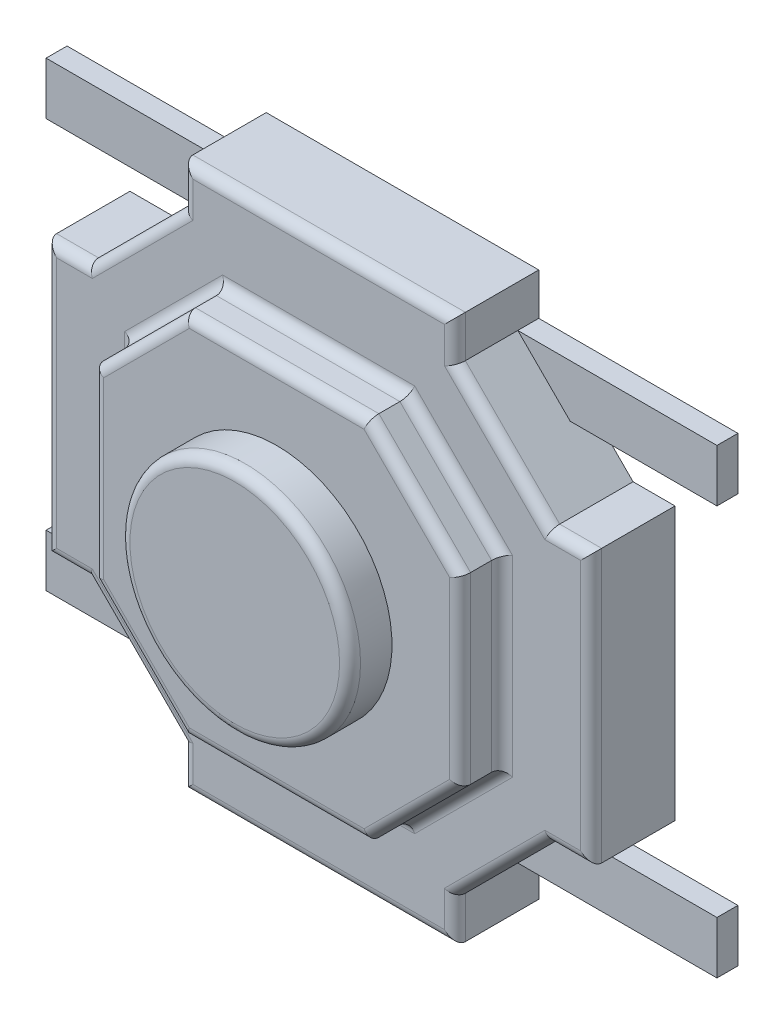
from build123d import *

# Parameters (mm, degrees)
BOSS_EXTRUDE1_DEPTH = 0.8
SKETCH3_W           = 6.4
SKETCH3_H           = 0.5
BOSS_EXTRUDE2_DEPTH = 0.2
BOSS_EXTRUDE3_DEPTH = 0.4
SKETCH5_R           = 1.1
BOSS_EXTRUDE4_DEPTH = 0.4
FILLET2_R           = 0.1
FILLET3_R           = 0.1
FILLET4_R           = 0.1


with BuildPart() as part:
    # Sketch1 → Boss-Extrude1 (new body)
    with BuildSketch(Plane.XY):
        Polygon((-1.3, 2.6), (1.3, 2.6), (1.3, 2.2), (2.2, 1.3), (2.6, 1.3), (2.6, -1.3), (2.2, -1.3), (1.3, -2.2), (1.3, -2.6), (-1.3, -2.6), (-1.3, -2.2), (-2.2, -1.3), (-2.6, -1.3), (-2.6, 1.3), (-2.2, 1.3), (-1.3, 2.2), align=None)
    extrude(amount=BOSS_EXTRUDE1_DEPTH)

    # Sketch3 → Boss-Extrude2 (add)
    with BuildSketch(Plane.XY):
        with Locations((0, 1.95)):
            Rectangle(SKETCH3_W, SKETCH3_H)
        with Locations((0, -1.95)):
            Rectangle(SKETCH3_W, SKETCH3_H)
    extrude(amount=BOSS_EXTRUDE2_DEPTH)

    # Sketch4 → Boss-Extrude3 (add)
    with BuildSketch(Plane.XY.offset(0.8)):
        Polygon((-0.875, 1.75), (0.875, 1.75), (1.75, 0.875), (1.75, -0.875), (0.875, -1.75), (-0.875, -1.75), (-1.75, -0.875), (-1.75, 0.875), align=None)
    extrude(amount=BOSS_EXTRUDE3_DEPTH)

    # Sketch5 → Boss-Extrude4 (add)
    with BuildSketch(Plane.XY.offset(1.2)):
        with Locations(Location((0, 0, 0), (0, 0, 180))):
            Circle(SKETCH5_R)
    extrude(amount=BOSS_EXTRUDE4_DEPTH)

    # Fillet2
    fillet2_edges = [part.edges().sort_by_distance(p)[0] for p in [
        (1.1, 0, 1.6),
    ]]
    fillet(fillet2_edges, radius=FILLET2_R)

    # Fillet3
    fillet3_edges = [part.edges().sort_by_distance(p)[0] for p in [
        (1.3, 2.4, 0.8),
        (0, 2.6, 0.8),
        (-1.3, 2.4, 0.8),
        (-1.75, 1.75, 0.8),
        (-2.4, 1.3, 0.8),
        (-2.6, 0, 0.8),
        (-2.4, -1.3, 0.8),
        (-1.75, -1.75, 0.8),
        (-1.3, -2.4, 0.8),
        (0, -2.6, 0.8),
        (2.4, 1.3, 0.8),
        (1.3, -2.4, 0.8),
        (1.75, -1.75, 0.8),
        (2.4, -1.3, 0.8),
        (2.6, 0, 0.8),
        (1.75, 1.75, 0.8),
        (1.3125, 1.3125, 0.8),
        (0, 1.75, 0.8),
        (-1.3125, 1.3125, 0.8),
        (-1.75, 0, 0.8),
        (-1.3125, -1.3125, 0.8),
        (0, -1.75, 0.8),
        (1.3125, -1.3125, 0.8),
        (1.75, 0, 0.8),
    ]]
    fillet(fillet3_edges, radius=FILLET3_R)

    # Fillet4
    fillet4_edges = [part.edges().sort_by_distance(p)[0] for p in [
        (0, 1.75, 1.2),
        (-1.3125, 1.3125, 1.2),
        (-1.75, 0, 1.2),
        (-1.3125, -1.3125, 1.2),
        (0, -1.75, 1.2),
        (1.3125, -1.3125, 1.2),
        (1.75, 0, 1.2),
        (1.3125, 1.3125, 1.2),
    ]]
    fillet(fillet4_edges, radius=FILLET4_R)


solid = part.part
